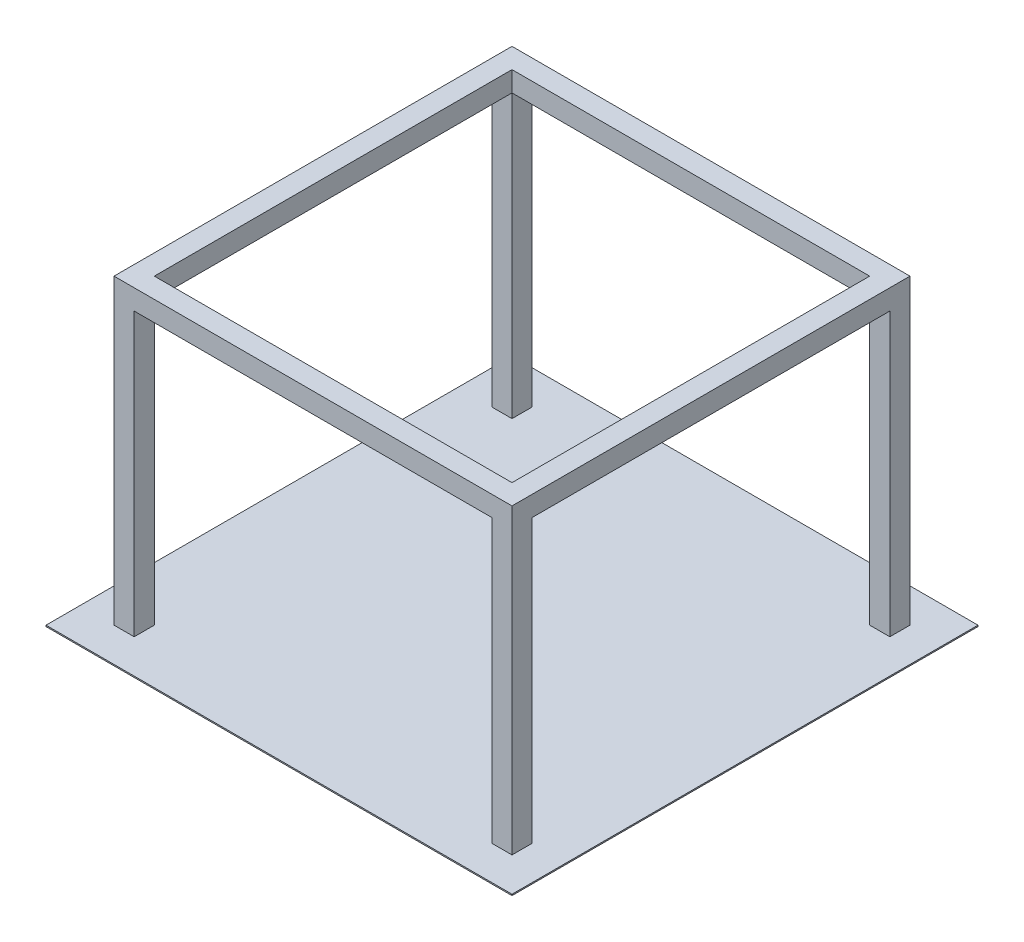
from build123d import *

# Parameters (mm, degrees)
SKETCH1_W               = 1850
SKETCH1_H               = 1850
BOSS_EXTRUDE1_DEPTH     = 5
SKETCH2_W               = 1580
SKETCH2_H               = 1580
BOSS_EXTRUDE2_DEPTH     = 1200
CUT_EXTRUDE1_DEPTH      = 1779.559810633
CUT_EXTRUDE1_DEPTH_BACK = 1779.559810633
SKETCH3_W               = 1420
SKETCH3_H               = 1120
CUT_EXTRUDE2_DEPTH      = 1779.559810633
CUT_EXTRUDE2_DEPTH_BACK = 1779.559810633
SKETCH4_W               = 1420
SKETCH4_H               = 1120
SKETCH5_W               = 1420
SKETCH5_H               = 1420
CUT_EXTRUDE3_DEPTH      = 80


with BuildPart() as part:
    # Sketch1 → Boss-Extrude1 (new body)
    with BuildSketch(Plane(origin=(0, 0, 0), x_dir=(1, 0, 0), z_dir=(0, 1, 0))):
        Rectangle(SKETCH1_W, SKETCH1_H)
    extrude(amount=BOSS_EXTRUDE1_DEPTH)


with BuildPart() as body_2:
    # Sketch2 → Boss-Extrude2 (new body)
    with BuildSketch(Plane(origin=(0, 5, 0), x_dir=(1, 0, 0), z_dir=(0, 1, 0))):
        Rectangle(SKETCH2_W, SKETCH2_H)
    extrude(amount=BOSS_EXTRUDE2_DEPTH)

    # Sketch3 → Cut-Extrude1 (cut, two sides: drawn at the far end of the back side and taken through both)
    with BuildSketch(Plane.XY.offset(-CUT_EXTRUDE1_DEPTH_BACK)):
        with Locations((0, 565)):
            Rectangle(SKETCH3_W, SKETCH3_H)
    extrude(amount=CUT_EXTRUDE1_DEPTH + CUT_EXTRUDE1_DEPTH_BACK, mode=Mode.SUBTRACT)

    # Sketch4 → Cut-Extrude2 (cut, two sides: drawn at the far end of the back side and taken through both)
    with BuildSketch(Plane(origin=(0, 0, 0), x_dir=(0, 0, -1), z_dir=(1, 0, 0)).offset(-CUT_EXTRUDE2_DEPTH_BACK)):
        with Locations((0, 565)):
            Rectangle(SKETCH4_W, SKETCH4_H)
    extrude(amount=CUT_EXTRUDE2_DEPTH + CUT_EXTRUDE2_DEPTH_BACK, mode=Mode.SUBTRACT)

    # Sketch5 → Cut-Extrude3 (cut)
    with BuildSketch(Plane(origin=(0, 1205, 0), x_dir=(1, 0, 0), z_dir=(0, 1, 0))):
        Rectangle(SKETCH5_W, SKETCH5_H)
    extrude(amount=-CUT_EXTRUDE3_DEPTH, mode=Mode.SUBTRACT)


solid = Compound([part.part, body_2.part])
